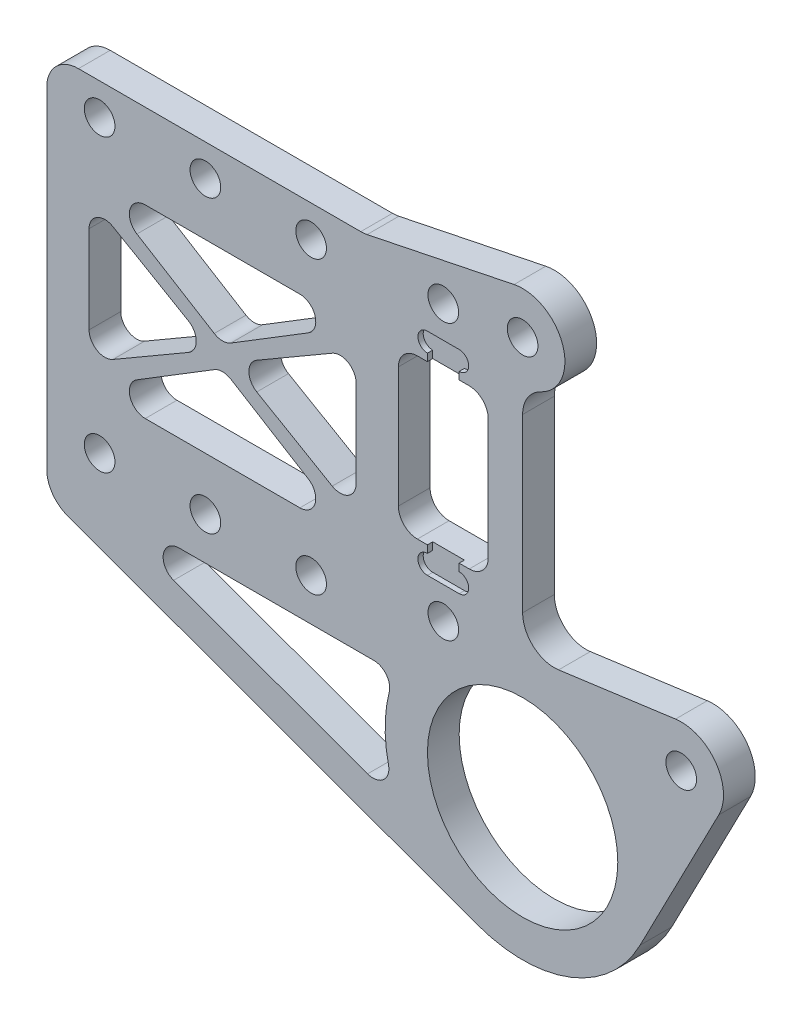
from build123d import *

# Parameters (mm, degrees)
SKETCH_2_R          = 9
SKETCH_2_R_2        = 1.45
EXTRUDE_1_DEPTH     = 3
EXTRUDE_START       = -3
SKETCH_4_R          = 1.45
EXTRUDE_2_DEPTH     = 3
SKETCH_5_R          = 1.45
SKETCH_5_W          = 8.5
SKETCH_5_H          = 15
EXTRUDE_3_DEPTH     = 3
SKETCH_6_W          = 3
SKETCH_6_H          = 20
CUT_EXTRUDE_2_DEPTH = 0.5
SKETCH_7_R          = 1.45
CUT_EXTRUDE_3_DEPTH = 20
FILLET_1_R          = 1.8
FILLET_2_R          = 3
SKETCH_8_R          = 0.9
CUT_EXTRUDE_4_DEPTH = 0.5
CUT_EXTRUDE_5_DEPTH = 10.5
FILLET_3_R          = 1.5


with BuildPart() as part:
    # 草图2 → 凸台-拉伸1 (new body)
    with BuildSketch(Plane.XY):
        with BuildLine():
            Line((-10, -7), (-10, -16.423561614))
            Line((-10, -16.423561614), (30.724748208, -31.24615776))
            ThreePointArc((30.724748208, -31.24615776), (47.310096913, -21.670602221), (35, -7))
            Line((35, -7), (-10, -7))
        make_face()
        with Locations((35, -19.5)):
            Circle(SKETCH_2_R, mode=Mode.SUBTRACT)
        with Locations((15, -10.5)):
            Circle(SKETCH_2_R_2, mode=Mode.SUBTRACT)
        with Locations((5, -10.5)):
            Circle(SKETCH_2_R_2, mode=Mode.SUBTRACT)
        with Locations((-5, -10.5)):
            Circle(SKETCH_2_R_2, mode=Mode.SUBTRACT)
    extrude(amount=EXTRUDE_1_DEPTH)

    # 草图4 → 凸台-拉伸2 (add)
    with BuildSketch(Plane.XY.offset(3).offset(EXTRUDE_START)):
        with BuildLine():
            Line((35, -7), (49.461817276, -5.036370432))
            ThreePointArc((49.461817276, -5.036370432), (53.268884157, -6.694702543), (53.552947171, -10.837543578))
            Line((53.552947171, -10.837543578), (46.102959909, -25.24232368))
            ThreePointArc((46.102959909, -25.24232368), (45.677758332, -13.00111725), (35, -7))
        make_face()
        with Locations((50, -9)):
            Circle(SKETCH_4_R, mode=Mode.SUBTRACT)
    extrude(amount=EXTRUDE_2_DEPTH)

    # 草图5 → 凸台-拉伸3 (add)
    with BuildSketch(Plane(origin=(0, 0, 0), x_dir=(-1, 0, 0), z_dir=(0, 0, -1))):
        with BuildLine():
            Line((-35, -7), (-35, 15))
            ThreePointArc((-35, 15), (-38.979463437, 19.404809528), (-34.194537642, 22.918064623))
            Line((-34.194537642, 22.918064623), (-20, 20))
            Line((-20, 20), (10, 20))
            Line((10, 20), (10, -7))
            Line((10, -7), (-35, -7))
        make_face()
        with Locations((-35, 19)):
            Circle(SKETCH_5_R, mode=Mode.SUBTRACT)
        with Locations((-27.5, 5)):
            Rectangle(SKETCH_5_W, SKETCH_5_H, mode=Mode.SUBTRACT)
    extrude(amount=-EXTRUDE_3_DEPTH)

    # 草图6 → 切除-拉伸2 (cut)
    with BuildSketch(Plane.XY.offset(3)):
        with Locations((27.5, 5)):
            Rectangle(SKETCH_6_W, SKETCH_6_H)
    extrude(amount=-CUT_EXTRUDE_2_DEPTH, mode=Mode.SUBTRACT)

    # 草图7 → 切除-拉伸3 (cut)
    with BuildSketch(Plane.XY.offset(3)):
        with Locations((27.5, 18)):
            Circle(SKETCH_7_R)
        with Locations(Location((27.5, -8, 0), (0, 0, 180))):
            Circle(SKETCH_7_R)
        with Locations((-5, 17)):
            Circle(SKETCH_7_R)
        with Locations((5, 17)):
            Circle(SKETCH_7_R)
        with Locations((15, 17)):
            Circle(SKETCH_7_R)
    extrude(amount=-CUT_EXTRUDE_3_DEPTH, mode=Mode.SUBTRACT)

    # 圆角1
    fillet_1_edges = [part.edges().sort_by_distance(p)[0] for p in [
        (31.75, 12.5, 1.5),
        (23.25, 12.5, 1.5),
        (23.25, -2.5, 1.5),
        (31.75, -2.5, 1.5),
    ]]
    fillet(fillet_1_edges, radius=FILLET_1_R)

    # 圆角2
    fillet_2_edges = [part.edges().sort_by_distance(p)[0] for p in [
        (35, 15, 1.5),
        (20, 20, 1.5),
        (-10, 20, 1.5),
        (35, -7, 1.5),
        (-10, -16.423561614, 1.5),
    ]]
    fillet(fillet_2_edges, radius=FILLET_2_R)

    # 草图8 → 切除-拉伸4 (cut)
    with BuildSketch(Plane.XY.offset(3)):
        with Locations((26, 14.1)):
            Circle(SKETCH_8_R)
        with Locations((29, 14.1)):
            Circle(SKETCH_8_R)
        with Locations((26, -4.1)):
            Circle(SKETCH_8_R)
        with Locations((29, -4.1)):
            Circle(SKETCH_8_R)
    extrude(amount=-CUT_EXTRUDE_4_DEPTH, mode=Mode.SUBTRACT)

    # 草图9 → 切除-拉伸5 (cut)
    with BuildSketch(Plane(origin=(0, 0, 0), x_dir=(-1, 0, 0), z_dir=(0, 0, -1))):
        Polygon((-6.625, 4.25), (-19.25, 12), (6, 12), align=None)
        Polygon((-7.625, 3.25), (-19.25, 10), (-19.25, -3.5), align=None)
        Polygon((6, 10), (6, -3.5), (-5.625, 3.25), align=None)
        Polygon((-19.25, -5.5), (6, -5.5), (-6.625, 2.25), align=None)
        with BuildLine():
            Line((-23, -14.5), (6, -14.5))
            Line((6, -14.5), (-23.298682976, -25.163848506))
            ThreePointArc((-23.298682976, -25.163848506), (-22.005096252, -19.863973337), (-23, -14.5))
        make_face()
    extrude(amount=-CUT_EXTRUDE_5_DEPTH, mode=Mode.SUBTRACT)

    # 圆角3
    fillet_3_edges = [part.edges().sort_by_distance(p)[0] for p in [
        (7.625, 3.25, 1.5),
        (19.25, -3.5, 1.5),
        (19.25, 10, 1.5),
        (23.298682976, -25.163848506, 1.5),
        (23, -14.5, 1.5),
        (-6, -14.5, 1.5),
        (19.25, -5.5, 1.5),
        (6.625, 2.25, 1.5),
        (-6, -5.5, 1.5),
        (5.625, 3.25, 1.5),
        (-6, 10, 1.5),
        (-6, -3.5, 1.5),
        (-6, 12, 1.5),
        (6.625, 4.25, 1.5),
        (19.25, 12, 1.5),
    ]]
    fillet(fillet_3_edges, radius=FILLET_3_R)


solid = part.part
